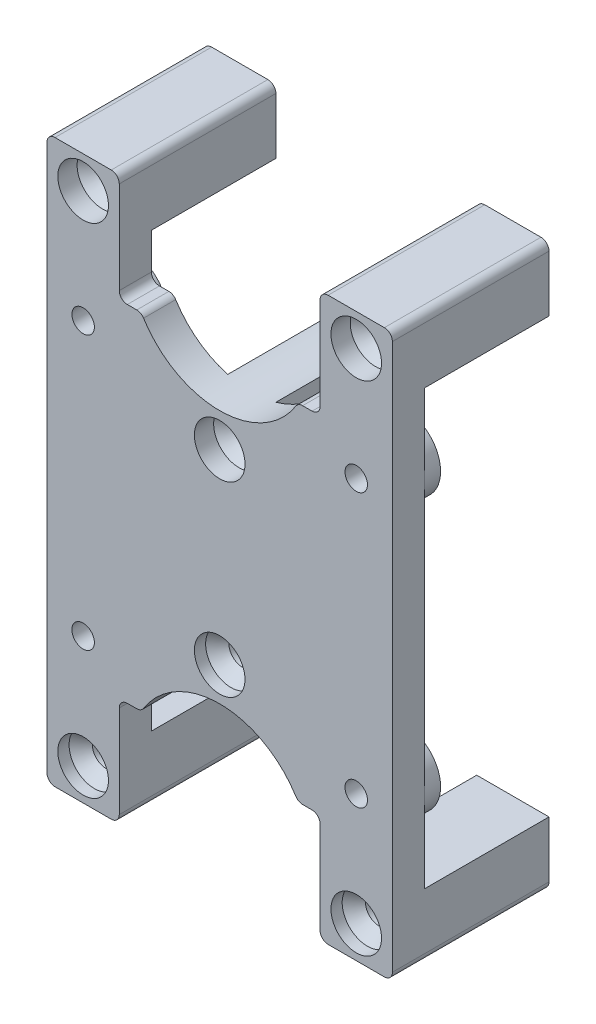
from build123d import *

# Parameters (mm, degrees)
BOSS_EXTRUDE1_DEPTH                            = 4
SKETCH5_R                                      = 4.5
BOSS_EXTRUDE2_DEPTH                            = 2
SKETCH7_W                                      = 6
SKETCH7_H                                      = 14.5
BOSS_EXTRUDE3_DEPTH                            = 15.5
SKETCH13_W                                     = 9
SKETCH13_H                                     = 8
BOSS_EXTRUDE4_DEPTH                            = 15.5
SKETCH6_R                                      = 11.2
CUT_EXTRUDE1_DEPTH                             = 46.469770178
F_2_8_2_8_DIAMETER_HOLE1_D                     = 2.8
CSK_FOR_M3_FLAT_HEAD_MACHINE_SCREW1_AT_2_COUNT = 2
CSK_FOR_M3_FLAT_HEAD_MACHINE_SCREW1_AT_2_PITCH = 25.791089833
CSK_FOR_M3_FLAT_HEAD_MACHINE_SCREW1_AT_3_COUNT = 2
CSK_FOR_M3_FLAT_HEAD_MACHINE_SCREW1_AT_3_PITCH = 25.791089833
CSK_FOR_M3_FLAT_HEAD_MACHINE_SCREW2_AT_2_COUNT = 2
CSK_FOR_M3_FLAT_HEAD_MACHINE_SCREW2_AT_2_PITCH = 25.791089833
CSK_FOR_M3_FLAT_HEAD_MACHINE_SCREW2_AT_3_COUNT = 2
CSK_FOR_M3_FLAT_HEAD_MACHINE_SCREW2_AT_3_PITCH = 25.791089833
FILLET2_R                                      = 1


with BuildPart() as part:
    # Sketch2 → Boss-Extrude1 (new body)
    with BuildSketch(Plane.XY):
        Polygon((-21.5, 35), (-21.5, -35), (-12.5, -35), (-12.5, -21.5), (12.5, -21.5), (12.5, -35), (21.5, -35), (21.5, 35), (12.5, 35), (12.5, 21.5), (-12.5, 21.5), (-12.5, 35), align=None)
    extrude(amount=BOSS_EXTRUDE1_DEPTH)

    # Sketch5 → Boss-Extrude2 (add)
    with BuildSketch(Plane(origin=(0, 0, 0), x_dir=(-1, 0, 0), z_dir=(0, 0, -1))):
        with Locations(Location((-17, 17, 0), (0, 0, 180))):
            Circle(SKETCH5_R)
        with Locations((17, 17)):
            Circle(SKETCH5_R)
        with Locations((17, -17)):
            Circle(SKETCH5_R)
        with Locations(Location((-17, -17, 0), (0, 0, 180))):
            Circle(SKETCH5_R)
    extrude(amount=BOSS_EXTRUDE2_DEPTH)

    # Sketch7 → Boss-Extrude3 (add)
    with BuildSketch(Plane(origin=(0, 0, 0), x_dir=(-1, 0, 0), z_dir=(0, 0, -1))):
        with Locations((0, 14.25)):
            Rectangle(SKETCH7_W, SKETCH7_H)
        with Locations((0, -14.25)):
            Rectangle(SKETCH7_W, SKETCH7_H)
    extrude(amount=BOSS_EXTRUDE3_DEPTH)

    # Sketch13 → Boss-Extrude4 (add)
    with BuildSketch(Plane(origin=(0, 0, 0), x_dir=(-1, 0, 0), z_dir=(0, 0, -1))):
        with Locations((-17, 31)):
            Rectangle(SKETCH13_W, SKETCH13_H)
        with Locations((17, 31)):
            Rectangle(SKETCH13_W, SKETCH13_H)
        with Locations((17, -31)):
            Rectangle(SKETCH13_W, SKETCH13_H)
        with Locations((-17, -31)):
            Rectangle(SKETCH13_W, SKETCH13_H)
    extrude(amount=BOSS_EXTRUDE4_DEPTH)

    # Sketch6 → Cut-Extrude1 (cut, through all)
    with BuildSketch(Plane.XY.offset(4)):
        with Locations((0, 27)):
            Circle(SKETCH6_R)
    cut_extrude1 = extrude(amount=-CUT_EXTRUDE1_DEPTH, mode=Mode.SUBTRACT)

    # Mirror1: Cut-Extrude1 across plane
    add(cut_extrude1.mirror(Plane.ZX), mode=Mode.SUBTRACT)

    # Ø2.8 (2.8) Diameter Hole1 (through all)
    with Locations(Plane.XY.offset(4)):
        with Locations((-17, 17), (17, 17), (17, -17), (-17, -17)):
            Hole(F_2_8_2_8_DIAMETER_HOLE1_D / 2)

    # Sketch9 → CSK for M3 Flat Head Machine Screw1 (revolve, cut)
    with BuildSketch(Plane(origin=(0, 11.604631616, 4), x_dir=(0, -1, 0), z_dir=(1, 0, 0))):
        Polygon((0, 0), (0, 19.5), (1.7, 19.5), (1.7, 3.85), (3.15, 2.4), (3.15, 0), align=None)
    csk_for_m3_flat_head_machine_screw1 = revolve(axis=Axis((0, 11.604631616, 10.35), (0, 0, -1)), mode=Mode.SUBTRACT)

    # CSK for M3 Flat Head Machine Screw1 at 2: CSK for M3 Flat Head Machine Screw1 ×2
    with Locations(*[Vector(0.6591423670083493, 0.7520181779815104, 0) * (i * CSK_FOR_M3_FLAT_HEAD_MACHINE_SCREW1_AT_2_PITCH) for i in range(1, CSK_FOR_M3_FLAT_HEAD_MACHINE_SCREW1_AT_2_COUNT)]):
        add(csk_for_m3_flat_head_machine_screw1, mode=Mode.SUBTRACT)

    # CSK for M3 Flat Head Machine Screw1 at 3: CSK for M3 Flat Head Machine Screw1 ×2
    with Locations(*[Vector(-0.6591423670083494, 0.7520181779815103, 0) * (i * CSK_FOR_M3_FLAT_HEAD_MACHINE_SCREW1_AT_3_PITCH) for i in range(1, CSK_FOR_M3_FLAT_HEAD_MACHINE_SCREW1_AT_3_COUNT)]):
        add(csk_for_m3_flat_head_machine_screw1, mode=Mode.SUBTRACT)

    # Sketch11 → CSK for M3 Flat Head Machine Screw2 (revolve, cut)
    with BuildSketch(Plane(origin=(0, -11.604631616, 4), x_dir=(0, -1, 0), z_dir=(1, 0, 0))):
        Polygon((0, 0), (0, 19.5), (1.7, 19.5), (1.7, 2.85), (3.15, 1.4), (3.15, 0), align=None)
    csk_for_m3_flat_head_machine_screw2 = revolve(axis=Axis((0, -11.604631616, 10.35), (0, 0, -1)), mode=Mode.SUBTRACT)

    # CSK for M3 Flat Head Machine Screw2 at 2: CSK for M3 Flat Head Machine Screw2 ×2
    with Locations(*[Vector(-0.6591423670083494, -0.7520181779815103, 0) * (i * CSK_FOR_M3_FLAT_HEAD_MACHINE_SCREW2_AT_2_PITCH) for i in range(1, CSK_FOR_M3_FLAT_HEAD_MACHINE_SCREW2_AT_2_COUNT)]):
        add(csk_for_m3_flat_head_machine_screw2, mode=Mode.SUBTRACT)

    # CSK for M3 Flat Head Machine Screw2 at 3: CSK for M3 Flat Head Machine Screw2 ×2
    with Locations(*[Vector(0.6591423670083493, -0.7520181779815104, 0) * (i * CSK_FOR_M3_FLAT_HEAD_MACHINE_SCREW2_AT_3_PITCH) for i in range(1, CSK_FOR_M3_FLAT_HEAD_MACHINE_SCREW2_AT_3_COUNT)]):
        add(csk_for_m3_flat_head_machine_screw2, mode=Mode.SUBTRACT)

    # Fillet2
    fillet2_edges = [part.edges().sort_by_distance(p)[0] for p in [
        (9.756536271, 21.5, 2),
        (-9.756536271, 21.5, 2),
        (9.756536271, -21.5, 2),
        (-9.756536271, -21.5, 2),
        (-12.5, 35, -5.75),
        (-12.5, 21.5, 2),
        (12.5, 21.5, 2),
        (12.5, 35, -5.75),
        (21.5, 35, -5.75),
        (21.5, -35, -5.75),
        (12.5, -35, -5.75),
        (12.5, -21.5, 2),
        (-12.5, -21.5, 2),
        (-12.5, -35, -5.75),
        (-21.5, -35, -5.75),
        (-21.5, 35, -5.75),
        (3, 7, -7.75),
        (-3, 7, -7.75),
        (-3, -7, -7.75),
        (3, -7, -7.75),
    ]]
    fillet(fillet2_edges, radius=FILLET2_R)


solid = part.part
